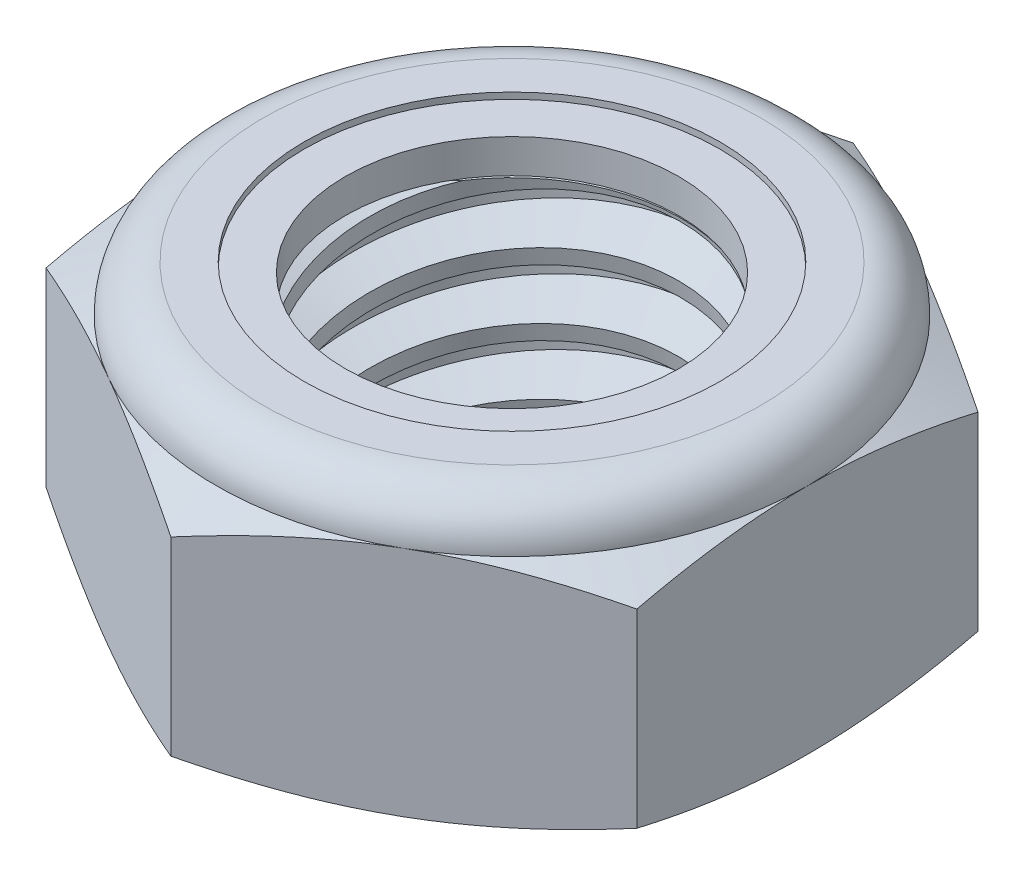
from build123d import *

# Parameters (mm, degrees)
EXTRUDE1_DEPTH      = 6.746875
SKETCH2_W           = 4.7625
SKETCH2_H           = 6.746875
LPATTERN1_COUNT     = 4
LPATTERN1_PITCH     = 1.5875
LPATTERN1_COL_COUNT = 2
LPATTERN1_COL_PITCH = 1.5875


with BuildPart() as part:
    # Sketch1 → Extrude1 (new body)
    with BuildSketch(Plane(origin=(0, 0, 0), x_dir=(1, 0, 0), z_dir=(0, 1, 0))):
        Polygon((0, 8.248891971), (-7.14375, 4.124445986), (-7.14375, -4.124445986), (0, -8.248891971), (7.14375, -4.124445986), (7.14375, 4.124445986), align=None)
    extrude(amount=EXTRUDE1_DEPTH)

    # Sketch4 → Cut-Revolve2 (revolve, cut)
    with BuildSketch(Plane(origin=(0, 0, 0), x_dir=(0, 0, -1), z_dir=(1, 0, 0))):
        Polygon((0, 6.746875), (4.7625, 6.746875), (4.029111805, 6.404890468), (4.029111805, 0.341984532), (4.7625, 0), (0, 0), align=None)
    revolve(axis=Axis((0, 6.746875, 0), (0, 1, 0)), mode=Mode.SUBTRACT)


with BuildPart() as body_2:
    # Sketch2 → Revolve1 (revolve)
    with BuildSketch(Plane(origin=(0, 0, 0), x_dir=(0, 0, -1), z_dir=(1, 0, 0))):
        with Locations((2.38125, 3.3734375)):
            Rectangle(SKETCH2_W, SKETCH2_H)
    revolve(axis=Axis((0, -4.7625, 0), (0, 1, 0)))

    # Sketch3 → Cut-Revolve1 (revolve, cut)
    with BuildSketch(Plane(origin=(0, 0, 0), x_dir=(0, 0, -1), z_dir=(1, 0, 0)), mode=Mode.PRIVATE) as cut_revolve1_sk:
        Polygon((4.795122924, 6.551137456), (5.023483392, 5.180974646), (4.094357653, 5.529057102), (4.029111805, 5.92053219), align=None)
    cut_revolve1 = revolve(cut_revolve1_sk.sketch.rotate(Axis((0, 6.746875, 0.28317269), (0, -0.9863939238321437, -0.16439898730535757)), 180), axis=Axis((0, 6.746875, 0.28317269), (0, -0.9863939238321437, -0.16439898730535757)), mode=Mode.SUBTRACT)

    # LPattern1: Cut-Revolve1 ×4
    with Locations(*[(0, -i * LPATTERN1_PITCH, 0) for i in range(1, LPATTERN1_COUNT)]):
        add(cut_revolve1, mode=Mode.SUBTRACT)

    # LPattern1 col: Cut-Revolve1 ×2
    with Locations(*[(0, i * LPATTERN1_COL_PITCH, 0) for i in range(1, LPATTERN1_COL_COUNT)]):
        add(cut_revolve1, mode=Mode.SUBTRACT)


with BuildPart() as part_1:
    add(part.part)

    # Combine1: cut body 2
    add(body_2.part, mode=Mode.SUBTRACT)

    # Sketch5 → Cut-Revolve3 (revolve, cut)
    with BuildSketch(Plane(origin=(0, 0, 0), x_dir=(0, 0, -1), z_dir=(1, 0, 0)), mode=Mode.PRIVATE) as cut_revolve3_sk:
        with BuildLine():
            Line((0, 0), (7.14375, 0))
            Line((7.14375, 0), (8.248891971, 0.515336164))
            Line((8.248891971, 0.515336164), (8.248891971, 5.107059669))
            Line((8.248891971, 5.107059669), (7.14375, 5.622395833))
            ThreePointArc((7.14375, 5.622395833), (6.814397677, 6.417522677), (6.019270833, 6.746875))
            Line((6.019270833, 6.746875), (6.019270833, 8.016875))
            Line((6.019270833, 8.016875), (9.518891971, 8.016875))
            Line((9.518891971, 8.016875), (9.518891971, -1.27))
            Line((9.518891971, -1.27), (0, -1.27))
            Line((0, -1.27), (0, 0))
        make_face()
    revolve(cut_revolve3_sk.sketch.rotate(Axis((0, 0, 0), (0, 1, 0)), 55.157981045), axis=Axis((0, 0, 0), (0, 1, 0)), mode=Mode.SUBTRACT)

    # Sketch6 → Cut-Revolve4 (revolve, cut)
    with BuildSketch(Plane(origin=(0, 0, 0), x_dir=(0, 0, -1), z_dir=(1, 0, 0)), mode=Mode.PRIVATE) as cut_revolve4_sk:
        with BuildLine():
            Line((0, 5.622395833), (6.99135, 5.622395833))
            ThreePointArc((6.99135, 5.622395833), (6.706634604, 6.309759604), (6.019270833, 6.594475))
            Line((6.019270833, 6.594475), (5.024191319, 6.594475))
            Line((5.024191319, 6.594475), (5.024191319, 8.016875))
            Line((5.024191319, 8.016875), (0, 8.016875))
            Line((0, 8.016875), (0, 5.622395833))
        make_face()
    revolve(cut_revolve4_sk.sketch.rotate(Axis((0, 8.016875, 0), (0, 1, 0)), 55.157981045), axis=Axis((0, 8.016875, 0), (0, 1, 0)), mode=Mode.SUBTRACT)


with BuildPart() as body_2_2:
    # Sketch7 → Revolve2 (revolve)
    with BuildSketch(Plane(origin=(0, 0, 0), x_dir=(0, 0, -1), z_dir=(1, 0, 0))):
        with BuildLine():
            Line((4.029111805, 5.698595833), (6.91190348, 5.698595833))
            ThreePointArc((6.91190348, 5.698595833), (6.625213689, 6.282269107), (6.019270833, 6.518275))
            Line((6.019270833, 6.518275), (4.029111805, 6.518275))
            Line((4.029111805, 6.518275), (4.029111805, 5.698595833))
        make_face()
    revolve(axis=Axis((0, 5.698595833, 0), (0, 1, 0)))


solid = Compound([part_1.part, body_2_2.part])
